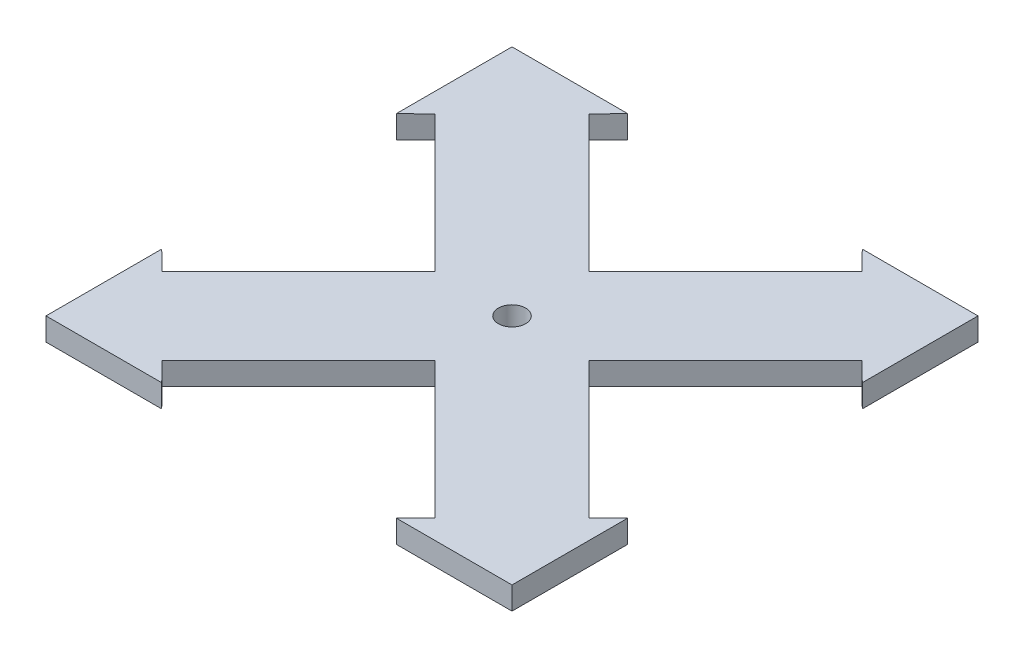
from build123d import *

# Parameters (mm, degrees)
CROQUIS1_R              = 1.5
SALIENTE_EXTRUIR1_DEPTH = 2.5


with BuildPart() as part:
    # Croquis1 → Saliente-Extruir1 (new body)
    with BuildSketch(Plane(origin=(0, 0, 0), x_dir=(1, 0, 0), z_dir=(0, 1, 0))):
        Polygon((-15, -23.485281374), (0, -8.485281374), (15, -23.485281374), (12.902154963, -25.629820066), (25.629820066, -25.629820066), (25.629820066, -12.902154963), (23.485281374, -15), (8.485281374, 0), (23.485281374, 15), (25.629820066, 12.902154963), (25.629820066, 25.629820066), (12.902154963, 25.629820066), (15, 23.485281374), (0, 8.485281374), (-15, 23.485281374), (-12.902154963, 25.629820066), (-25.629820066, 25.629820066), (-25.629820066, 12.902154963), (-23.485281374, 15), (-8.485281374, 0), (-23.485281374, -15), (-25.629820066, -12.902154963), (-25.629820066, -25.629820066), (-12.902154963, -25.629820066), align=None)
        with Locations(Location((0, 0, 0), (0, 0, 270))):
            Circle(CROQUIS1_R, mode=Mode.SUBTRACT)
    extrude(amount=SALIENTE_EXTRUIR1_DEPTH)


solid = part.part
